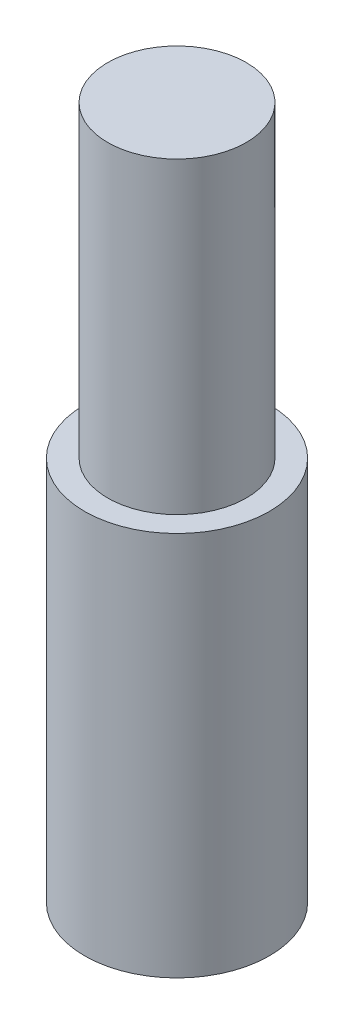
from build123d import *


with BuildPart() as part:
    # Skizze1 → Rotation3 (revolve)
    with BuildSketch(Plane.XY, mode=Mode.PRIVATE) as rotation3_sk:
        Polygon((0, 45), (0, 0), (6, 0), (6, 25), (4.5, 25), (4.5, 45), align=None)
    revolve(rotation3_sk.sketch.rotate(Axis((0, -3.346016205, 0), (0, 1, 0)), 90), axis=Axis((0, -3.346016205, 0), (0, 1, 0)))


solid = part.part
